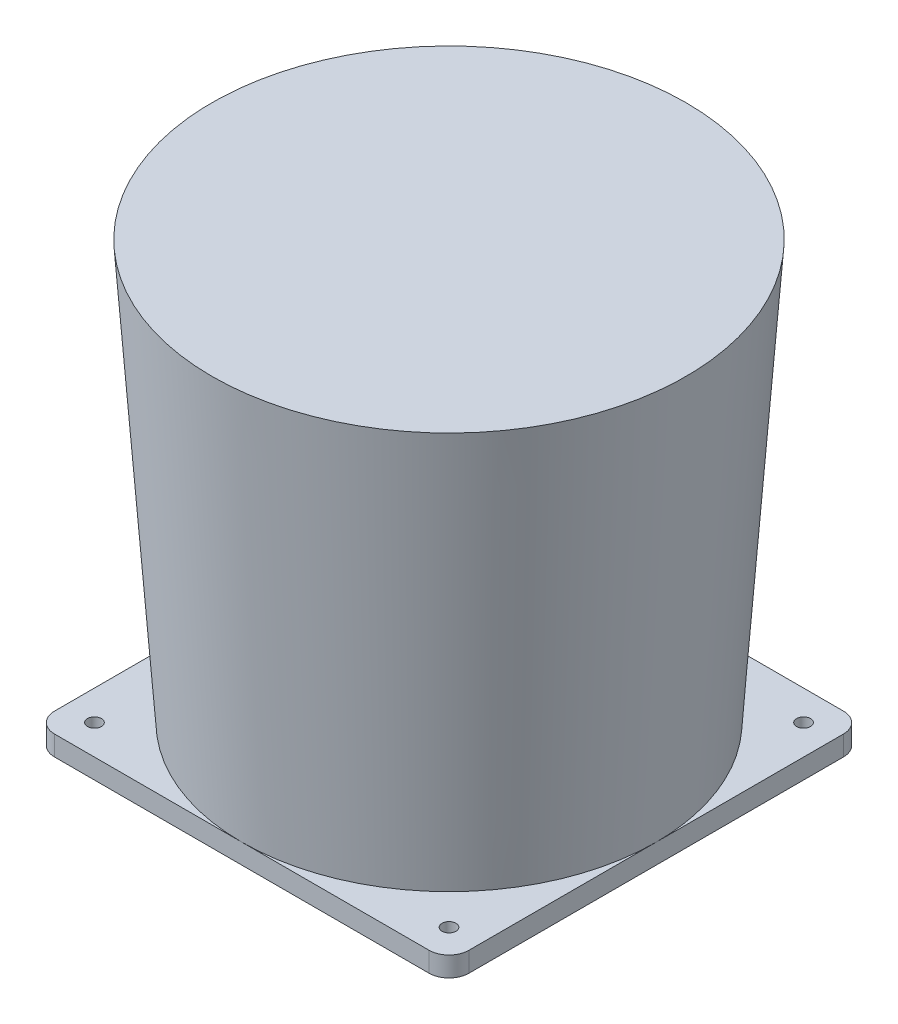
from build123d import *

# Parameters (mm, degrees)
SKETCH2_R           = 3.5
BOSS_EXTRUDE1_DEPTH = 10
SKETCH4_R           = 119
SKETCH3_R           = 104


with BuildPart() as part:
    # Sketch2 → Boss-Extrude1 (new body)
    with BuildSketch(Plane(origin=(0, 0, 0), x_dir=(1, 0, 0), z_dir=(0, 1, 0))):
        with BuildLine():
            Line((-94, 104), (94, 104))
            ThreePointArc((94, 104), (101.071067812, 101.071067812), (104, 94))
            Line((104, 94), (104, -94))
            ThreePointArc((104, -94), (101.071067812, -101.071067812), (94, -104))
            Line((94, -104), (-94, -104))
            ThreePointArc((-94, -104), (-101.071067812, -101.071067812), (-104, -94))
            Line((-104, -94), (-104, 94))
            ThreePointArc((-104, 94), (-101.071067812, 101.071067812), (-94, 104))
        make_face()
        with Locations(Location((-89, 89, 0), (0, 0, 270))):
            Circle(SKETCH2_R, mode=Mode.SUBTRACT)
        with Locations(Location((89, 89, 0), (0, 0, 270))):
            Circle(SKETCH2_R, mode=Mode.SUBTRACT)
        with Locations(Location((89, -89, 0), (0, 0, 270))):
            Circle(SKETCH2_R, mode=Mode.SUBTRACT)
        with Locations(Location((-89, -89, 0), (0, 0, 270))):
            Circle(SKETCH2_R, mode=Mode.SUBTRACT)
    extrude(amount=BOSS_EXTRUDE1_DEPTH)

    # Sketch4 → Loft1 section 0
    with BuildSketch(Plane(origin=(0, 220, 0), x_dir=(1, 0, 0), z_dir=(0, 1, 0))):
        Circle(SKETCH4_R)
    # Sketch3 → Loft1 section 1
    with BuildSketch(Plane(origin=(0, 10, 0), x_dir=(1, 0, 0), z_dir=(0, 1, 0))):
        Circle(SKETCH3_R)
    loft()


solid = part.part
